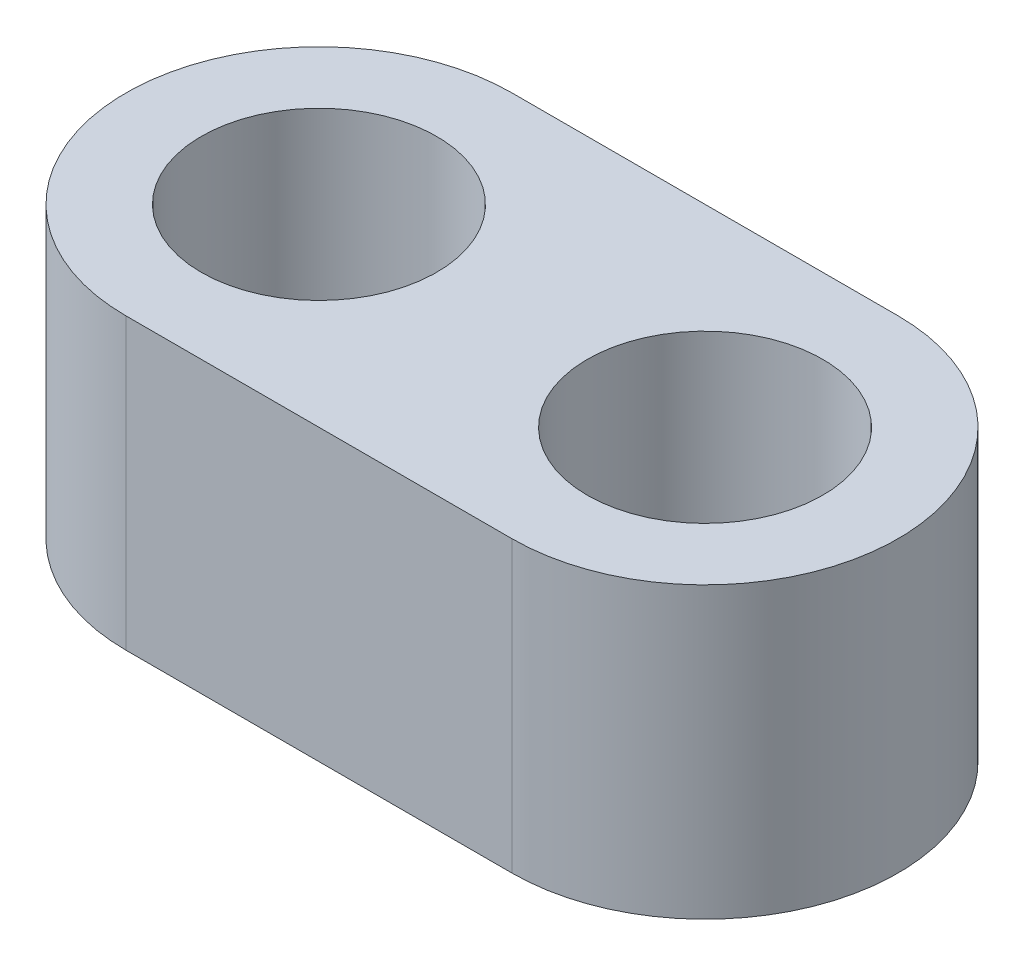
from build123d import *

# Parameters (mm, degrees)
SKETCH1_R           = 6.1
BOSS_EXTRUDE1_DEPTH = 15


with BuildPart() as part:
    # Sketch1 → Boss-Extrude1 (new body)
    with BuildSketch(Plane(origin=(0, 0, 0), x_dir=(1, 0, 0), z_dir=(0, 1, 0))):
        with BuildLine():
            Line((0, 10), (20, 10))
            ThreePointArc((20, 10), (30, 0), (20, -10))
            Line((20, -10), (0, -10))
            ThreePointArc((0, -10), (-10, 0), (0, 10))
        make_face()
        with Locations(Location((0, 0, 0), (0, 0, 270))):
            Circle(SKETCH1_R, mode=Mode.SUBTRACT)
        with Locations(Location((20, 0, 0), (0, 0, 270))):
            Circle(SKETCH1_R, mode=Mode.SUBTRACT)
    extrude(amount=BOSS_EXTRUDE1_DEPTH)


solid = part.part
